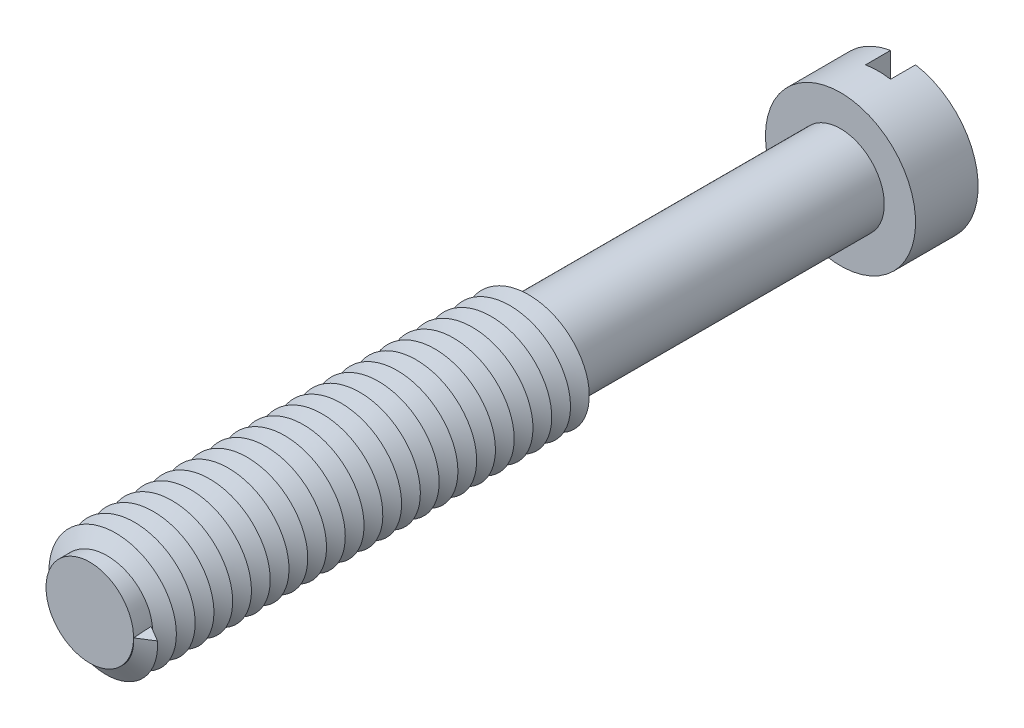
from build123d import *

# Parameters (mm, degrees)
SKETCH1_R           = 3.5
BOSS_EXTRUDE1_DEPTH = 60
SWEEP1_PITCH        = 1.5
SWEEP1_HEIGHT       = 35
SWEEP1_RADIUS       = 3.5
SWEEP1_START_ANGLE  = -180
SKETCH4_R           = 6
BOSS_EXTRUDE2_DEPTH = 5
SKETCH5_W           = 2
SKETCH5_H           = 12
CUT_EXTRUDE1_DEPTH  = 2


with BuildPart() as part:
    # Sketch1 → Boss-Extrude1 (new body)
    with BuildSketch(Plane.XY):
        with Locations(Location((0, 0, 0), (0, 0, 180))):
            Circle(SKETCH1_R)
    extrude(amount=BOSS_EXTRUDE1_DEPTH)

    # Sketch4 → Boss-Extrude2 (add)
    with BuildSketch(Plane(origin=(0, 0, 0), x_dir=(-1, 0, 0), z_dir=(0, 0, -1))):
        Circle(SKETCH4_R)
    extrude(amount=BOSS_EXTRUDE2_DEPTH)

    # Sketch5 → Cut-Extrude1 (cut)
    with BuildSketch(Plane(origin=(0, 0, -5), x_dir=(-1, 0, 0), z_dir=(0, 0, -1))):
        Rectangle(SKETCH5_W, SKETCH5_H)
    extrude(amount=-CUT_EXTRUDE1_DEPTH, mode=Mode.SUBTRACT)


with BuildPart() as body_2:
    # Sweep1: sweep along a helix
    with BuildLine() as sweep1_path:
        add(Helix(SWEEP1_PITCH, SWEEP1_HEIGHT, SWEEP1_RADIUS, center=(0, 0, 60), direction=(0, 0, -1), mode=Mode.PRIVATE).rotate(Axis((0, 0, 60), (0, 0, -1)), SWEEP1_START_ANGLE))
    # Sketch3 → Sweep1 (sweep)
    with BuildSketch(Plane(origin=(3.5, 0, 60), x_dir=(-1, 0, 0), z_dir=(0, -0.9976818341615725, -0.06805114094561995))):
        Polygon((0, 1.4), (0, 0), (-1.212435565, 0.7), align=None)
    sweep(path=sweep1_path.line, is_frenet=True)


solid = Compound([part.part, body_2.part])
